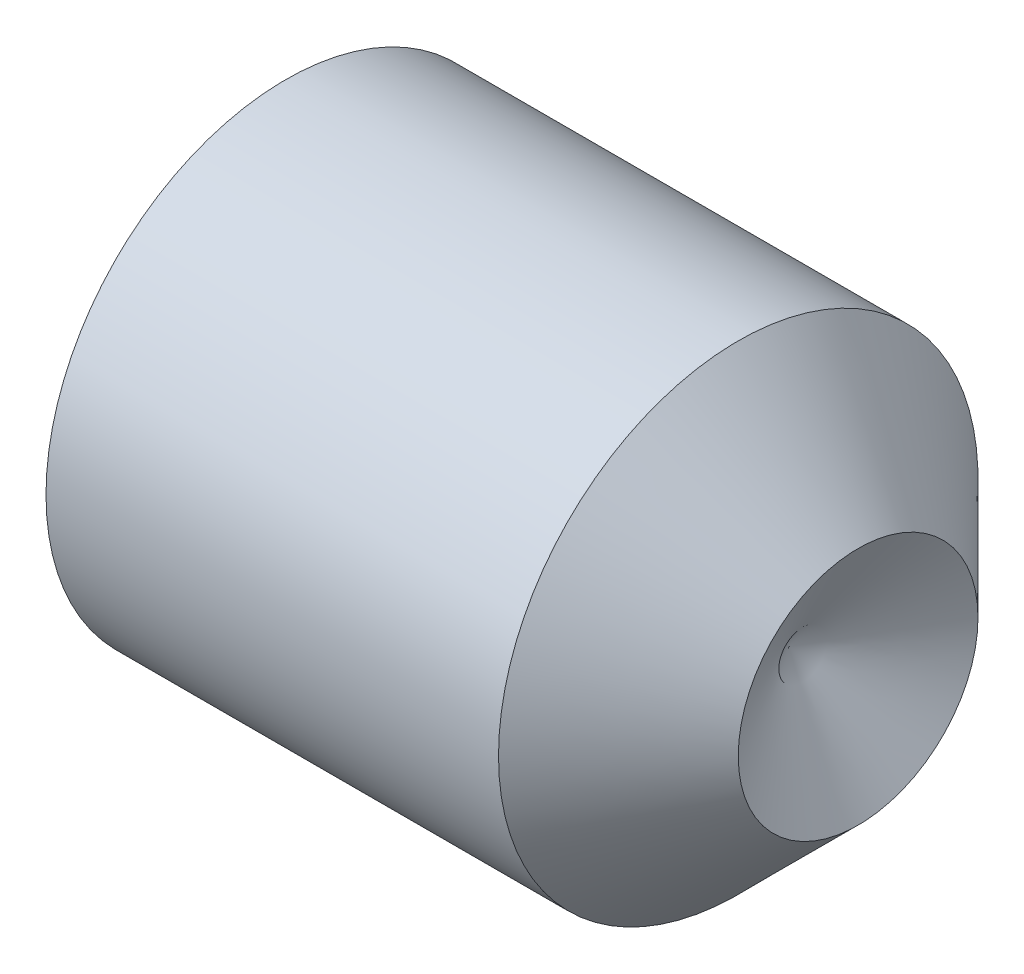
from build123d import *

# Parameters (mm, degrees)
HEX_2_DEPTH = 1.5


with BuildPart() as part:
    # BodySke → BaseBody (revolve)
    with BuildSketch(Plane.XY, mode=Mode.PRIVATE) as basebody_sk:
        Polygon((0, 0), (0, 1.61), (0.225166605, 2), (4, 2), (5, 1), (4.422649731, 0), align=None)
    revolve(basebody_sk.sketch.rotate(Axis((-12.7, 0, 0), (1, 0, 0)), 90), axis=Axis((-12.7, 0, 0), (1, 0, 0)))

    # Sketch2 → Hex 2 (cut)
    with BuildSketch(Plane.ZY):
        Polygon((0.577350269, 1), (-0.577350269, 1), (-1.154700538, 0), (-0.577350269, -1), (0.577350269, -1), (1.154700538, 0), align=None)
    extrude(amount=-HEX_2_DEPTH, mode=Mode.SUBTRACT)


solid = part.part
